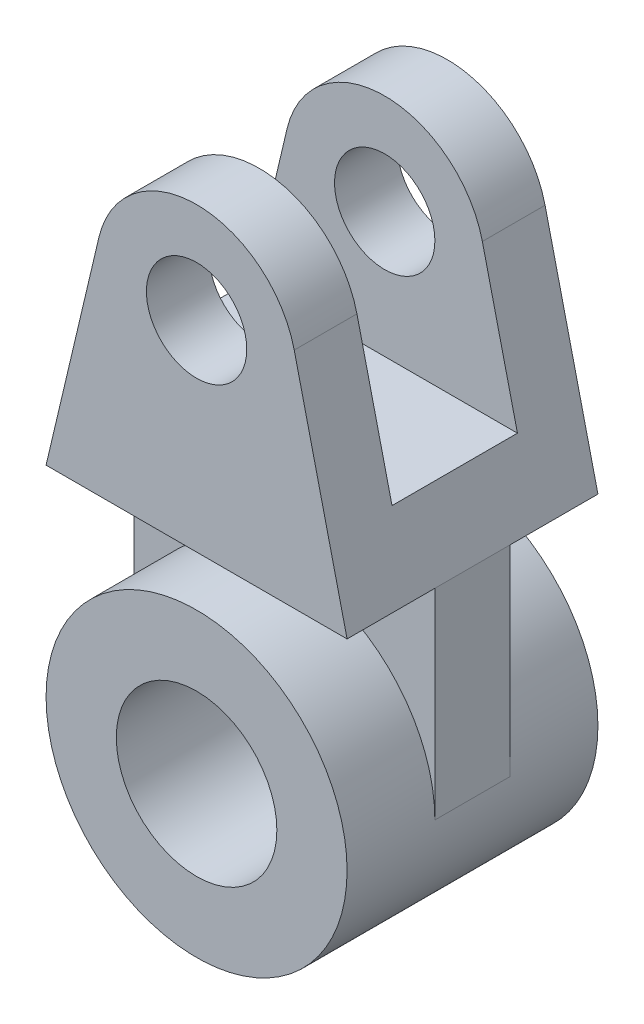
from build123d import *

# Parameters (mm, degrees)
SKETCH1_R           = 30
SKETCH1_R_2         = 16
BOSS_EXTRUDE1_DEPTH = 25
BOSS_EXTRUDE5_DEPTH = 7.5
BOSS_EXTRUDE6_DEPTH = 50
SKETCH7_3_R         = 10
BOSS_EXTRUDE7_DEPTH = 12.5


with BuildPart() as part:
    # Sketch1 → Boss-Extrude1 (new, symmetric)
    with BuildSketch(Plane.XY):
        Circle(SKETCH1_R)
        Circle(SKETCH1_R_2, mode=Mode.SUBTRACT)
    extrude(amount=BOSS_EXTRUDE1_DEPTH, both=True)

    # Sketch2 → Boss-Extrude5 (add, symmetric)
    with BuildSketch(Plane.XY):
        with BuildLine():
            ThreePointArc((-30, 0), (0, 30), (30, 0))
            Line((30, 0), (30, 40))
            Line((30, 40), (-30, 40))
            Line((-30, 40), (-30, 0))
        make_face()
    extrude(amount=BOSS_EXTRUDE5_DEPTH, both=True)

    # Sketch7 → Boss-Extrude6 (add)
    with BuildSketch(Plane.XY.offset(25)):
        Polygon((-30, 40), (30, 40), (26.456439237, 55), (-26.456439237, 55), align=None)
    extrude(amount=-BOSS_EXTRUDE6_DEPTH)

    # Sketch7<3> → Boss-Extrude7 (add)
    with BuildSketch(Plane.XY.offset(25)):
        with BuildLine():
            Line((-19.464242224, 84.598181668), (-26.456439237, 55))
            Line((-26.456439237, 55), (26.456439237, 55))
            Line((26.456439237, 55), (19.464242224, 84.598181668))
            ThreePointArc((19.464242224, 84.598181668), (0, 100), (-19.464242224, 84.598181668))
        make_face()
        with Locations((0, 80)):
            Circle(SKETCH7_3_R, mode=Mode.SUBTRACT)
    boss_extrude7 = extrude(amount=-BOSS_EXTRUDE7_DEPTH)

    # Mirror2: Boss-Extrude7 across plane
    add(boss_extrude7.mirror(Plane.XY))


solid = part.part
